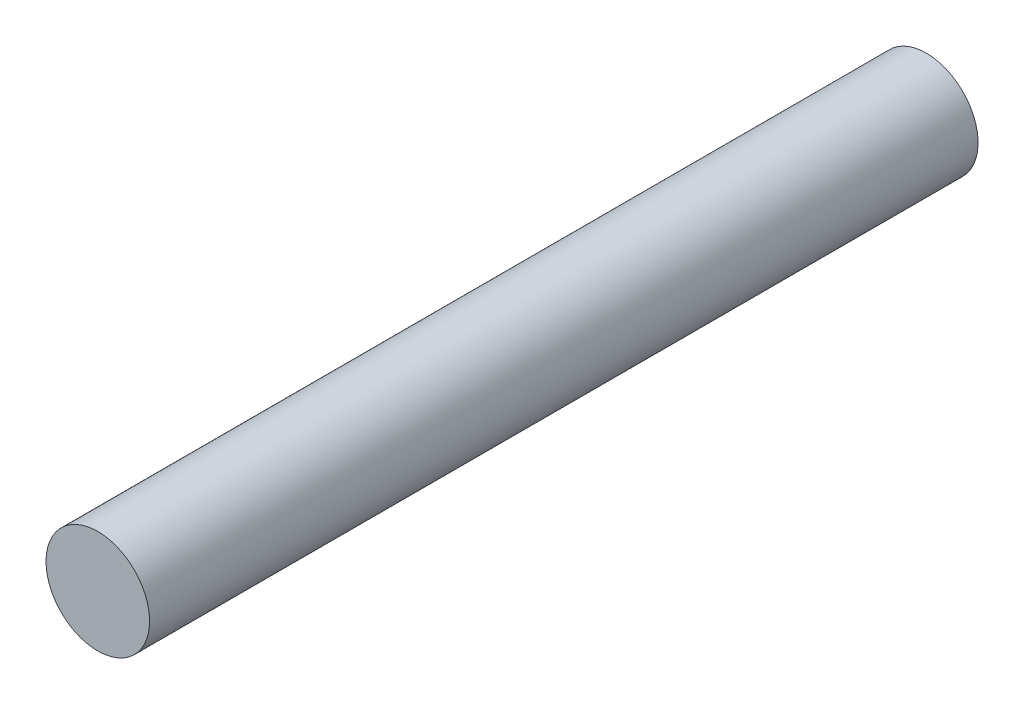
from build123d import *

# Parameters (mm, degrees)
SKETCH1_R           = 6.25
BOSS_EXTRUDE1_DEPTH = 100


with BuildPart() as part:
    # Sketch1 → Boss-Extrude1 (new body)
    with BuildSketch(Plane.XY):
        with Locations(Location((0, 0, 0), (0, 0, 180))):
            Circle(SKETCH1_R)
    extrude(amount=BOSS_EXTRUDE1_DEPTH)


solid = part.part
